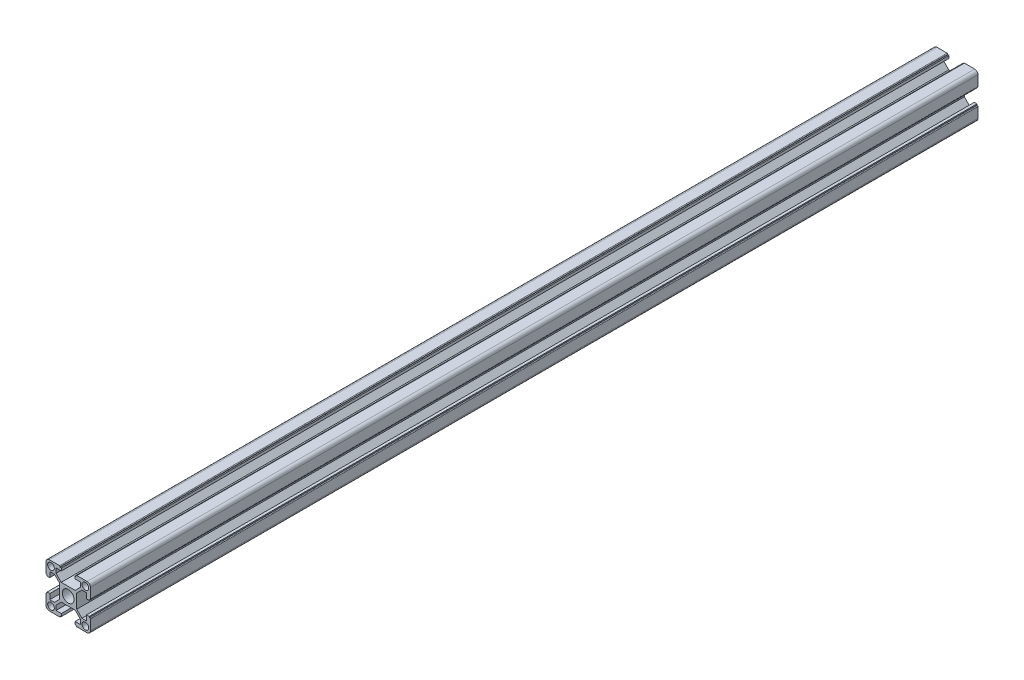
from build123d import *

# Parameters (mm, degrees)
SKETCH_1_R               = 2.65
SKETCH_1_R_2             = 1.5
EXTRUDE_1_DEPTH          = 200
CUT_EXTRUDE_1_DEPTH      = 201.499376558
CUT_EXTRUDE_1_DEPTH_BACK = 201.499376558
SKETCH_2_R               = 2.1
SKETCH_3_R               = 4.25
CUT_EXTRUDE_2_DEPTH      = 201.728230551
SKETCH_4_R               = 2.1
CUT_EXTRUDE_3_DEPTH      = 201.728230556


with BuildPart() as part:
    # 草图1 → 凸台-拉伸1 (new, symmetric)
    with BuildSketch(Plane.XY):
        with BuildLine():
            Line((3.142893219, 3.85), (-3.142893219, 3.85))
            Line((-3.142893219, 3.85), (-5.5, 6.207106781))
            Line((-5.5, 6.207106781), (-5.5, 8.3))
            Line((-5.5, 8.3), (-3.1, 8.3))
            Line((-3.1, 8.3), (-3.1, 9.5))
            Line((-3.1, 9.5), (-3.6, 9.5))
            Line((-3.6, 9.5), (-3.6, 9.7))
            ThreePointArc((-3.6, 9.7), (-3.687867966, 9.912132034), (-3.9, 10))
            Line((-3.9, 10), (-8.5, 10))
            ThreePointArc((-8.5, 10), (-9.560660172, 9.560660172), (-10, 8.5))
            Line((-10, 8.5), (-10, 3.9))
            ThreePointArc((-10, 3.9), (-9.912132034, 3.687867966), (-9.7, 3.6))
            Line((-9.7, 3.6), (-9.5, 3.6))
            Line((-9.5, 3.6), (-9.5, 3.1))
            Line((-9.5, 3.1), (-8.3, 3.1))
            Line((-8.3, 3.1), (-8.3, 5.5))
            Line((-8.3, 5.5), (-6.207106781, 5.5))
            Line((-6.207106781, 5.5), (-3.85, 3.142893219))
            Line((-3.85, 3.142893219), (-3.85, -3.142893219))
            Line((-3.85, -3.142893219), (-6.207106781, -5.5))
            Line((-6.207106781, -5.5), (-8.3, -5.5))
            Line((-8.3, -5.5), (-8.3, -3.1))
            Line((-8.3, -3.1), (-9.5, -3.1))
            Line((-9.5, -3.1), (-9.5, -3.6))
            Line((-9.5, -3.6), (-9.7, -3.6))
            ThreePointArc((-9.7, -3.6), (-9.912132034, -3.687867966), (-10, -3.9))
            Line((-10, -3.9), (-10, -8.5))
            ThreePointArc((-10, -8.5), (-9.560660172, -9.560660172), (-8.5, -10))
            Line((-8.5, -10), (-3.9, -10))
            ThreePointArc((-3.9, -10), (-3.687867966, -9.912132034), (-3.6, -9.7))
            Line((-3.6, -9.7), (-3.6, -9.5))
            Line((-3.6, -9.5), (-3.1, -9.5))
            Line((-3.1, -9.5), (-3.1, -8.3))
            Line((-3.1, -8.3), (-5.5, -8.3))
            Line((-5.5, -8.3), (-5.5, -6.207106781))
            Line((-5.5, -6.207106781), (-3.142893219, -3.85))
            Line((-3.142893219, -3.85), (3.142893219, -3.85))
            Line((3.142893219, -3.85), (5.5, -6.207106781))
            Line((5.5, -6.207106781), (5.5, -8.3))
            Line((5.5, -8.3), (3.1, -8.3))
            Line((3.1, -8.3), (3.1, -9.5))
            Line((3.1, -9.5), (3.6, -9.5))
            Line((3.6, -9.5), (3.6, -9.7))
            ThreePointArc((3.6, -9.7), (3.687867966, -9.912132034), (3.9, -10))
            Line((3.9, -10), (8.5, -10))
            ThreePointArc((8.5, -10), (9.560660172, -9.560660172), (10, -8.5))
            Line((10, -8.5), (10, -3.9))
            ThreePointArc((10, -3.9), (9.912132034, -3.687867966), (9.7, -3.6))
            Line((9.7, -3.6), (9.5, -3.6))
            Line((9.5, -3.6), (9.5, -3.1))
            Line((9.5, -3.1), (8.3, -3.1))
            Line((8.3, -3.1), (8.3, -5.5))
            Line((8.3, -5.5), (6.207106781, -5.5))
            Line((6.207106781, -5.5), (3.85, -3.142893219))
            Line((3.85, -3.142893219), (3.85, 3.142893219))
            Line((3.85, 3.142893219), (6.207106781, 5.5))
            Line((6.207106781, 5.5), (8.3, 5.5))
            Line((8.3, 5.5), (8.3, 3.1))
            Line((8.3, 3.1), (9.5, 3.1))
            Line((9.5, 3.1), (9.5, 3.6))
            Line((9.5, 3.6), (9.7, 3.6))
            ThreePointArc((9.7, 3.6), (9.912132034, 3.687867966), (10, 3.9))
            Line((10, 3.9), (10, 8.5))
            ThreePointArc((10, 8.5), (9.560660172, 9.560660172), (8.5, 10))
            Line((8.5, 10), (3.9, 10))
            ThreePointArc((3.9, 10), (3.687867966, 9.912132034), (3.6, 9.7))
            Line((3.6, 9.7), (3.6, 9.5))
            Line((3.6, 9.5), (3.1, 9.5))
            Line((3.1, 9.5), (3.1, 8.3))
            Line((3.1, 8.3), (5.5, 8.3))
            Line((5.5, 8.3), (5.5, 6.207106781))
            Line((5.5, 6.207106781), (3.142893219, 3.85))
        make_face()
        Circle(SKETCH_1_R, mode=Mode.SUBTRACT)
        with Locations((-7.75, 7.75)):
            Circle(SKETCH_1_R_2, mode=Mode.SUBTRACT)
        with Locations((7.75, 7.75)):
            Circle(SKETCH_1_R_2, mode=Mode.SUBTRACT)
        with Locations((7.75, -7.75)):
            Circle(SKETCH_1_R_2, mode=Mode.SUBTRACT)
        with Locations((-7.75, -7.75)):
            Circle(SKETCH_1_R_2, mode=Mode.SUBTRACT)
    extrude(amount=EXTRUDE_1_DEPTH, both=True)

    # 草图2 → 切除-拉伸1 (cut, two sides: drawn at the far end of the back side and taken through both)
    with BuildSketch(Plane(origin=(0, 0, 0), x_dir=(1, 0, 0), z_dir=(0, 1, 0)).offset(-CUT_EXTRUDE_1_DEPTH_BACK)):
        with Locations(Location((0, 138, 0), (0, 0, 270))):
            Circle(SKETCH_2_R)
        with Locations(Location((0, -43, 0), (0, 0, 270))):
            Circle(SKETCH_2_R)
    extrude(amount=CUT_EXTRUDE_1_DEPTH + CUT_EXTRUDE_1_DEPTH_BACK, mode=Mode.SUBTRACT)

    # 草图3 → 切除-拉伸2 (cut, through all)
    with BuildSketch(Plane.XZ.offset(3.85)):
        with Locations((0, -138)):
            Circle(SKETCH_3_R)
        with Locations((0, 43)):
            Circle(SKETCH_3_R)
    extrude(amount=CUT_EXTRUDE_2_DEPTH, mode=Mode.SUBTRACT)

    # 草图4 → 切除-拉伸3 (cut, through all)
    with BuildSketch(Plane.ZY.offset(3.85)):
        with Locations((190, 0)):
            Circle(SKETCH_4_R)
    extrude(amount=-CUT_EXTRUDE_3_DEPTH, mode=Mode.SUBTRACT)


solid = part.part
